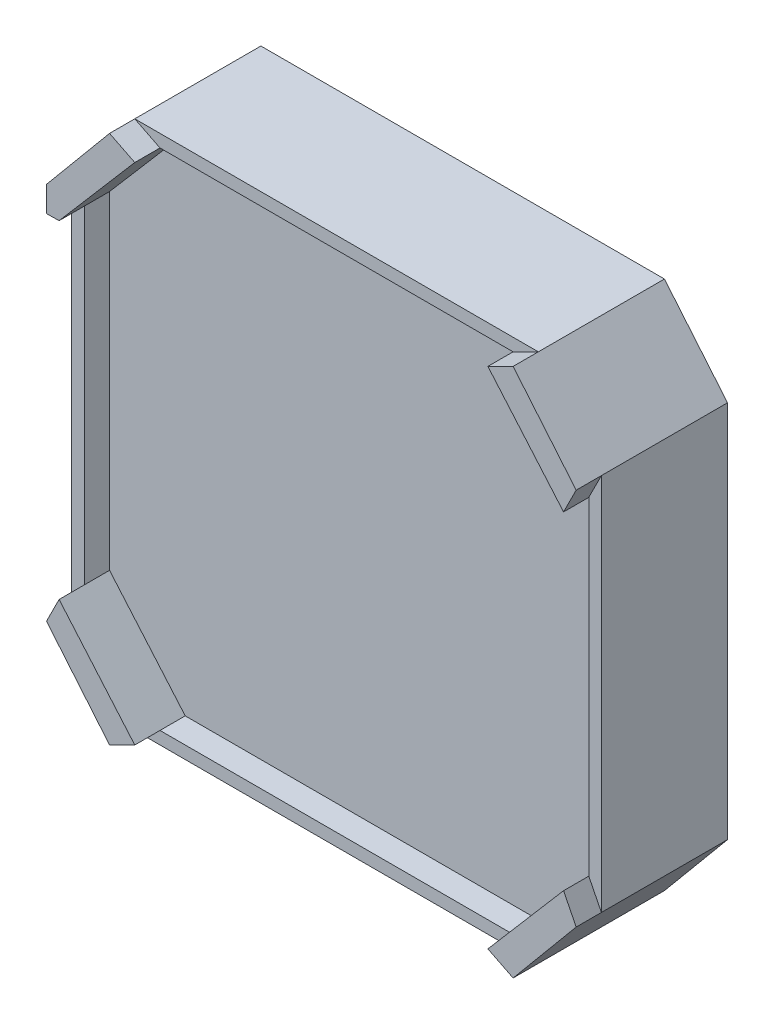
from build123d import *

# Parameters (mm, degrees)
SALIENTE_EXTRUIR1_DEPTH = 10
CORTAR_EXTRUIR1_DEPTH   = 2
SALIENTE_EXTRUIR2_DEPTH = 2
CROQUIS5_W              = 4
CROQUIS5_H              = 3
CORTAR_EXTRUIR2_DEPTH   = 3
CROQUIS6_R              = 1.4
CORTAR_EXTRUIR3_DEPTH   = 5


with BuildPart() as part:
    # Croquis2 → Saliente-Extruir1 (new body)
    with BuildSketch(Plane.XY):
        Polygon((-16, 21), (16, 21), (21, 15), (21, -15), (16, -21), (-16, -21), (-21, -15), (-21, 15), align=None)
    extrude(amount=SALIENTE_EXTRUIR1_DEPTH)

    # Croquis3 → Cortar-Extruir1 (cut)
    with BuildSketch(Plane.XY.offset(10)):
        Polygon((-14, 20), (14, 20), (20, 13.004934109), (20, -13.004934109), (14, -20), (-14, -20), (-20, -13.004934109), (-20, 13.004934109), align=None)
    extrude(amount=-CORTAR_EXTRUIR1_DEPTH, mode=Mode.SUBTRACT)

    # Croquis4 → Saliente-Extruir2 (add)
    with BuildSketch(Plane.XY.offset(10)):
        Polygon((-16, -21), (-14, -20), (-20, -13.004934109), (-21, -15), align=None)
        Polygon((-20, 13.004934109), (-14, 20), (-16, 21), (-21, 15), (-21, 12.992008233), align=None)
        Polygon((16, 21), (21, 15), (20, 13.004934109), (14, 20), align=None)
        Polygon((16, -21), (21, -15), (20, -13.004934109), (14, -20), align=None)
    extrude(amount=SALIENTE_EXTRUIR2_DEPTH)

    # Croquis5 → Cortar-Extruir2 (cut)
    with BuildSketch(Plane.XZ.offset(21)):
        with Locations((0, 5)):
            Rectangle(CROQUIS5_W, CROQUIS5_H)
    extrude(amount=-CORTAR_EXTRUIR2_DEPTH, mode=Mode.SUBTRACT)

    # Croquis6 → Cortar-Extruir3 (cut)
    with BuildSketch(Plane(origin=(0, 0, 0), x_dir=(-1, 0, 0), z_dir=(0, 0, -1))):
        with Locations((15.5, 15.5)):
            Circle(CROQUIS6_R)
        with Locations(Location((-15.5, 15.5, 0), (0, 0, 180))):
            Circle(CROQUIS6_R)
        with Locations(Location((15.5, -15.5, 0), (0, 0, 180))):
            Circle(CROQUIS6_R)
        with Locations((-15.5, -15.5)):
            Circle(CROQUIS6_R)
    extrude(amount=-CORTAR_EXTRUIR3_DEPTH, mode=Mode.SUBTRACT)


solid = part.part
